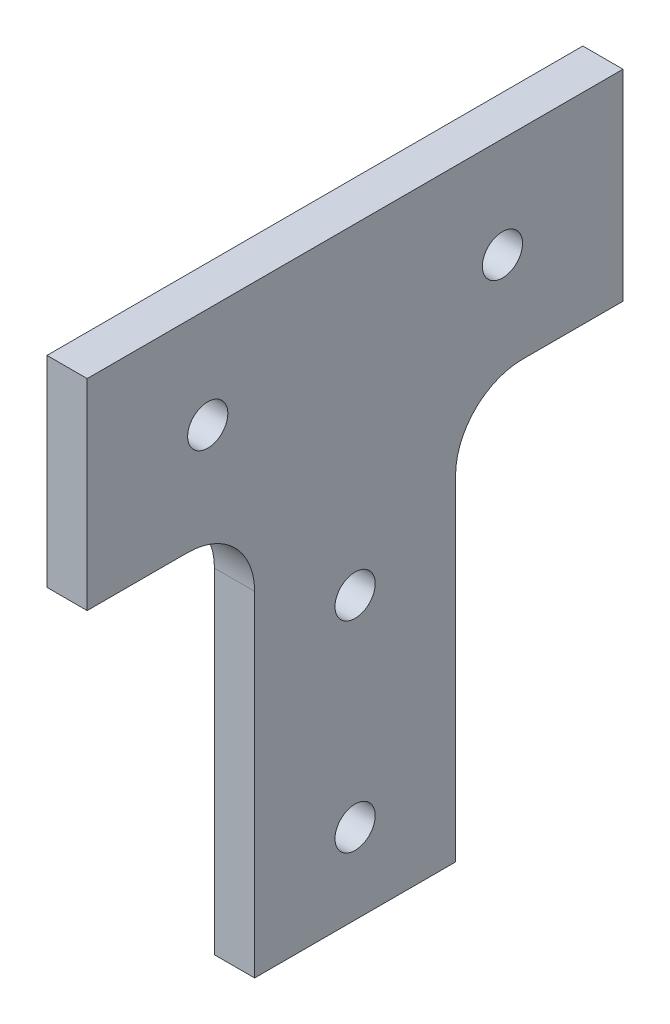
from build123d import *

# Parameters (mm, degrees)
EXTRUDE_1_DEPTH     = 3
SKETCH_2_R          = 1.5
CUT_EXTRUDE_1_DEPTH = 3


with BuildPart() as part:
    # 草图1 → 凸台-拉伸1 (new body)
    with BuildSketch(Plane(origin=(0, 0, 0), x_dir=(0, 0, -1), z_dir=(1, 0, 0))):
        with BuildLine():
            Line((0, 0), (40, 0))
            Line((40, 0), (40, -15))
            Line((40, -15), (32.5, -15))
            ThreePointArc((32.5, -15), (28.964466094, -16.464466094), (27.5, -20))
            Line((27.5, -20), (27.5, -45))
            Line((27.5, -45), (12.5, -45))
            Line((12.5, -45), (12.5, -20))
            ThreePointArc((12.5, -20), (11.035533906, -16.464466094), (7.5, -15))
            Line((7.5, -15), (0, -15))
            Line((0, -15), (0, 0))
        make_face()
    extrude(amount=EXTRUDE_1_DEPTH)

    # 草图2 → 切除-拉伸1 (cut)
    with BuildSketch(Plane(origin=(3, 0, 0), x_dir=(0, 0, -1), z_dir=(1, 0, 0))):
        with Locations((31, -7.5)):
            Circle(SKETCH_2_R)
        with Locations((9, -7.5)):
            Circle(SKETCH_2_R)
        with Locations((20, -39)):
            Circle(SKETCH_2_R)
        with Locations((20, -24)):
            Circle(SKETCH_2_R)
    extrude(amount=-CUT_EXTRUDE_1_DEPTH, mode=Mode.SUBTRACT)


solid = part.part
